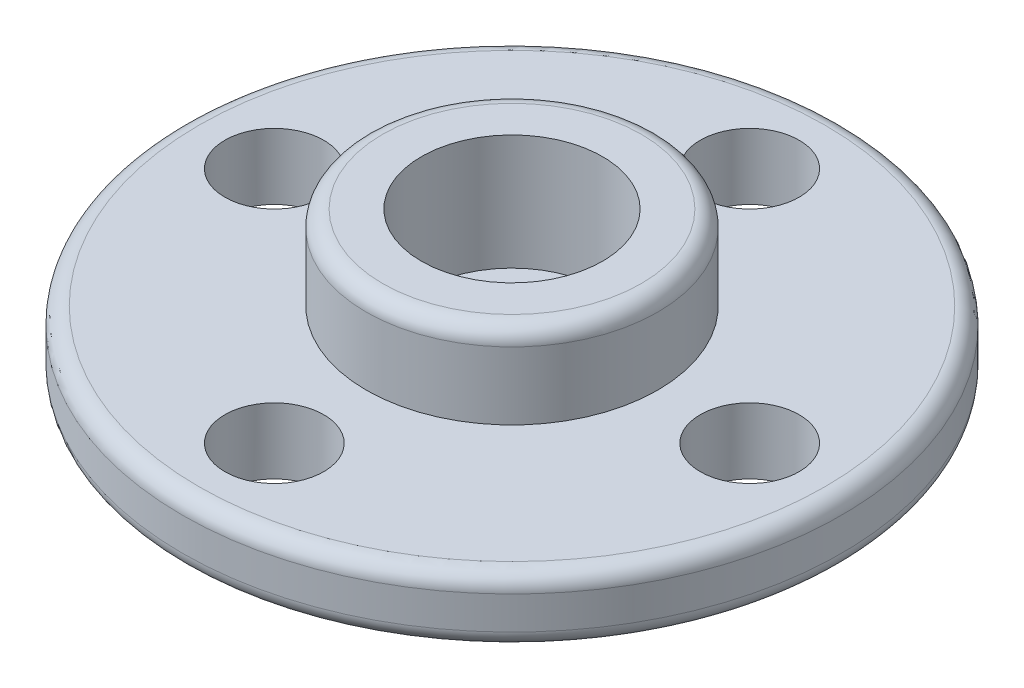
from build123d import *

# Parameters (mm, degrees)
SKETCH1_R               = 10
SKETCH1_R_2             = 4.425
BOSS_EXTRUDE1_DEPTH     = 2
SKETCH1_2_R             = 4.425
BOSS_EXTRUDE2_DEPTH     = 4.55
SKETCH2_R               = 2.75
CUT_EXTRUDE1_DEPTH      = 3.5
CUT_EXTRUDE2_DEPTH      = 15.85605937
CUT_EXTRUDE2_DEPTH_BACK = 15.85605937
SKETCH2_3_R             = 1.5
SKETCH3_R               = 1.5
CUT_EXTRUDE3_DEPTH      = 15.370194849
CIRPATTERN1_COUNT       = 4
FILLET1_R               = 0.5


with BuildPart() as part:
    # Sketch1 → Boss-Extrude1 (new body)
    with BuildSketch(Plane(origin=(0, 0, 0), x_dir=(1, 0, 0), z_dir=(0, 1, 0))):
        Circle(SKETCH1_R)
        Circle(SKETCH1_R_2, mode=Mode.SUBTRACT)
    extrude(amount=BOSS_EXTRUDE1_DEPTH)

    # Sketch1<2> → Boss-Extrude2 (add)
    with BuildSketch(Plane(origin=(0, 0, 0), x_dir=(1, 0, 0), z_dir=(0, 1, 0))):
        Circle(SKETCH1_2_R)
    extrude(amount=BOSS_EXTRUDE2_DEPTH)

    # Sketch2 → Cut-Extrude1 (cut)
    with BuildSketch(Plane(origin=(0, 4.55, 0), x_dir=(1, 0, 0), z_dir=(0, 1, 0))):
        Circle(SKETCH2_R)
    extrude(amount=-CUT_EXTRUDE1_DEPTH, mode=Mode.SUBTRACT)

    # Sketch2<3> → Cut-Extrude2 (cut, two sides: drawn at the far end of the back side and taken through both)
    with BuildSketch(Plane(origin=(0, 4.55, 0), x_dir=(1, 0, 0), z_dir=(0, 1, 0)).offset(-CUT_EXTRUDE2_DEPTH_BACK)):
        Circle(SKETCH2_3_R)
    extrude(amount=CUT_EXTRUDE2_DEPTH + CUT_EXTRUDE2_DEPTH_BACK, mode=Mode.SUBTRACT)

    # Sketch3 → Cut-Extrude3 (cut, symmetric)
    with BuildSketch(Plane(origin=(0, 2, 0), x_dir=(1, 0, 0), z_dir=(0, 1, 0))):
        with Locations((0, 7.2125)):
            Circle(SKETCH3_R)
    cut_extrude3 = extrude(amount=CUT_EXTRUDE3_DEPTH, both=True, mode=Mode.SUBTRACT)

    # CirPattern1: Cut-Extrude3 ×4 about axis
    cirpattern1_axis = Axis((0, 4.55, 0), (0, -1, 0))
    for i in range(1, CIRPATTERN1_COUNT):
        add(cut_extrude3.rotate(cirpattern1_axis, i * 360 / CIRPATTERN1_COUNT), mode=Mode.SUBTRACT)

    # Fillet1
    fillet1_edges = [part.edges().sort_by_distance(p)[0] for p in [
        (-4.425, 4.55, 0),
        (-10, 2, 0),
        (-10, 0, 0),
    ]]
    fillet(fillet1_edges, radius=FILLET1_R)


solid = part.part
